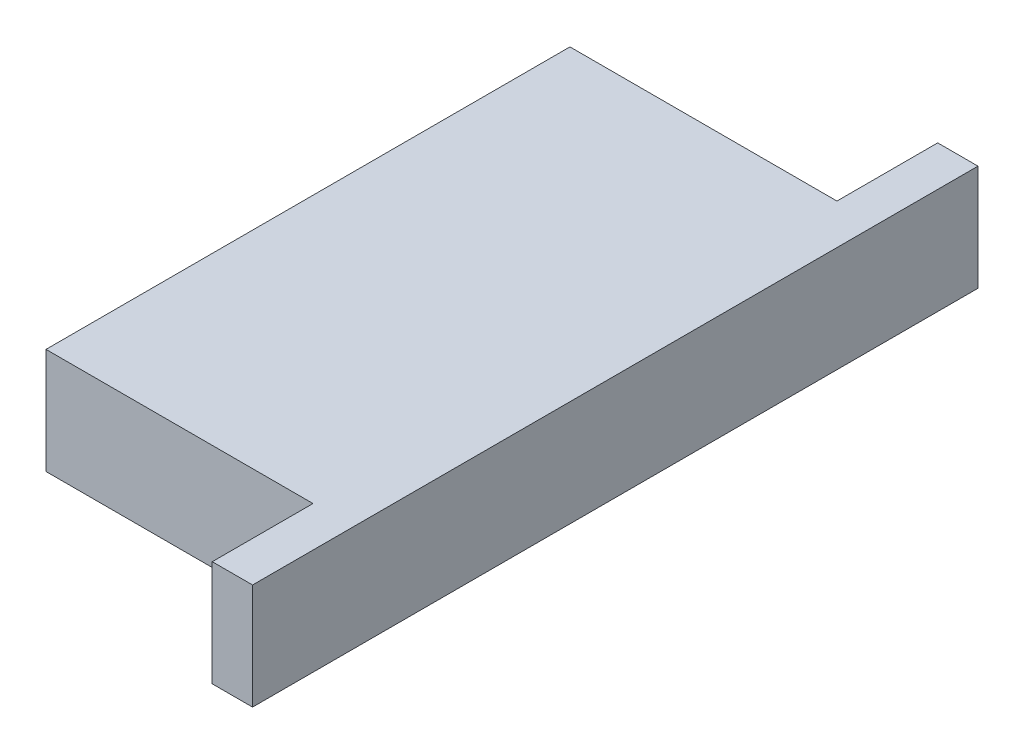
from build123d import *

# Parameters (mm, degrees)
BOSS_EXTRUDE1_DEPTH = 10.5


with BuildPart() as part:
    # Sketch1 → Boss-Extrude1 (new body)
    with BuildSketch(Plane(origin=(0, 0, 0), x_dir=(1, 0, 0), z_dir=(0, 1, 0))):
        Polygon((15.25, 36), (15.25, -36), (11.25, -36), (11.25, -26), (-15.25, -26), (-15.25, 26), (11.25, 26), (11.25, 36), align=None)
    extrude(amount=BOSS_EXTRUDE1_DEPTH)


solid = part.part
